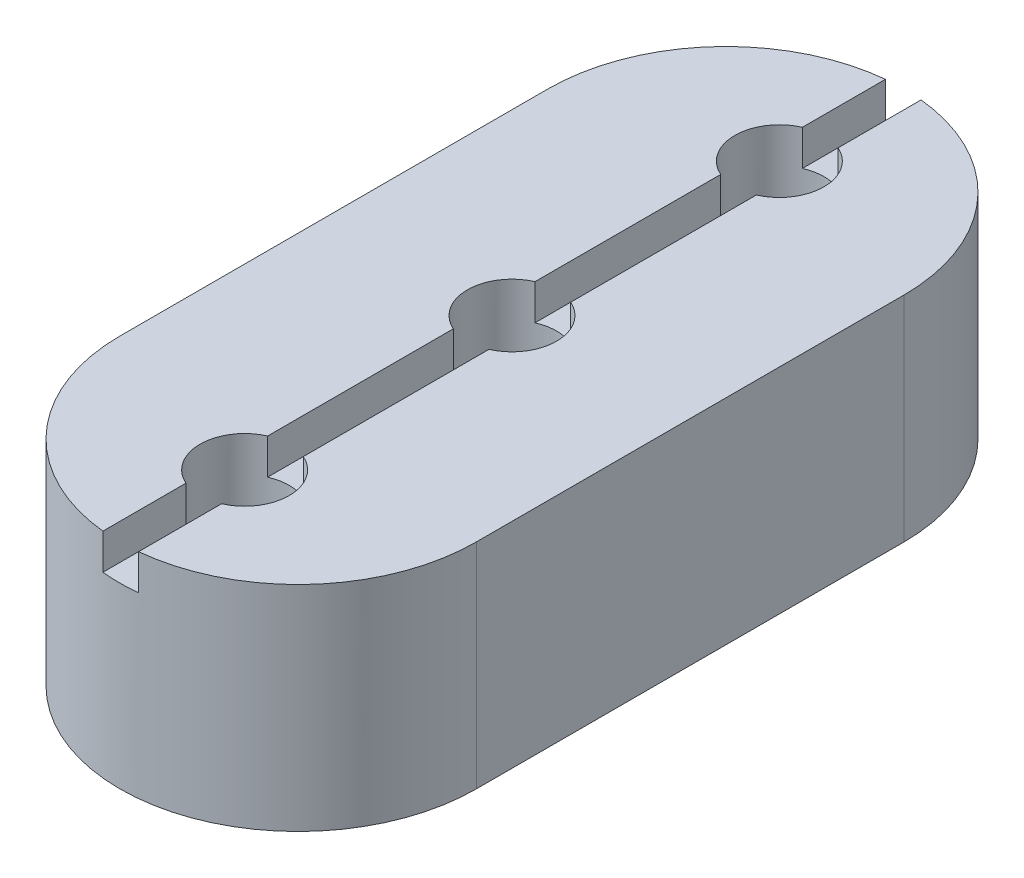
from build123d import *

# Parameters (mm, degrees)
SKETCH1_W             = 20
SKETCH1_H             = 12
BOSS_EXTRUDE1_DEPTH   = 22
M6X1_0_TAPPED_HOLE1_D = 5
SKETCH7_W             = 2
SKETCH7_H             = 2
CUT_EXTRUDE2_DEPTH    = 46.519226707
FILLET1_RADIUS        = 10
FILLET1_LENGTH        = 12
FILLET2_RADIUS        = 10
FILLET2_LENGTH        = 12


with BuildPart() as part:
    # Sketch1 → Boss-Extrude1 (new, symmetric)
    with BuildSketch(Plane.XY):
        Rectangle(SKETCH1_W, SKETCH1_H)
    extrude(amount=BOSS_EXTRUDE1_DEPTH, both=True)

    # M6x1.0 Tapped Hole1 (through all)
    with Locations(Plane(origin=(0, 6, 0), x_dir=(1, 0, 0), z_dir=(0, 1, 0))):
        with Locations((0, -15), (0, 0), (0, 15)):
            Hole(M6X1_0_TAPPED_HOLE1_D / 2)

    # Sketch7 → Cut-Extrude2 (cut, through all)
    with BuildSketch(Plane(origin=(0, 0, -22), x_dir=(-1, 0, 0), z_dir=(0, 0, -1))):
        with Locations((0, 5)):
            Rectangle(SKETCH7_W, SKETCH7_H)
    extrude(amount=-CUT_EXTRUDE2_DEPTH, mode=Mode.SUBTRACT)

    # Fillet1: full round fillet: the end face becomes a half cylinder, R = half its width
    fillet1_face = Plane((0, 0, -22), x_dir=(0, -1, 0), z_dir=(0, 0, -1))  # on the end face: x along it, z out of the body
    fillet1_slab = fillet1_face.offset(-FILLET1_RADIUS / 2) * Box(FILLET1_LENGTH, 2 * FILLET1_RADIUS, FILLET1_RADIUS, mode=Mode.PRIVATE)  # the body's end, R deep
    fillet1_round = Plane((0, 0, -12), x_dir=(0, 0, -1), z_dir=(0, -1, 0)) * Cylinder(FILLET1_RADIUS, FILLET1_LENGTH, mode=Mode.PRIVATE)  # its axis R under the face
    add(fillet1_slab - fillet1_round, mode=Mode.SUBTRACT)

    # Fillet2: full round fillet: the end face becomes a half cylinder, R = half its width
    fillet2_face = Plane((0, 0, 22), x_dir=(0, 1, 0), z_dir=(0, 0, 1))  # on the end face: x along it, z out of the body
    fillet2_slab = fillet2_face.offset(-FILLET2_RADIUS / 2) * Box(FILLET2_LENGTH, 2 * FILLET2_RADIUS, FILLET2_RADIUS, mode=Mode.PRIVATE)  # the body's end, R deep
    fillet2_round = Plane((0, 0, 12), x_dir=(0, 0, 1), z_dir=(0, 1, 0)) * Cylinder(FILLET2_RADIUS, FILLET2_LENGTH, mode=Mode.PRIVATE)  # its axis R under the face
    add(fillet2_slab - fillet2_round, mode=Mode.SUBTRACT)


solid = part.part
